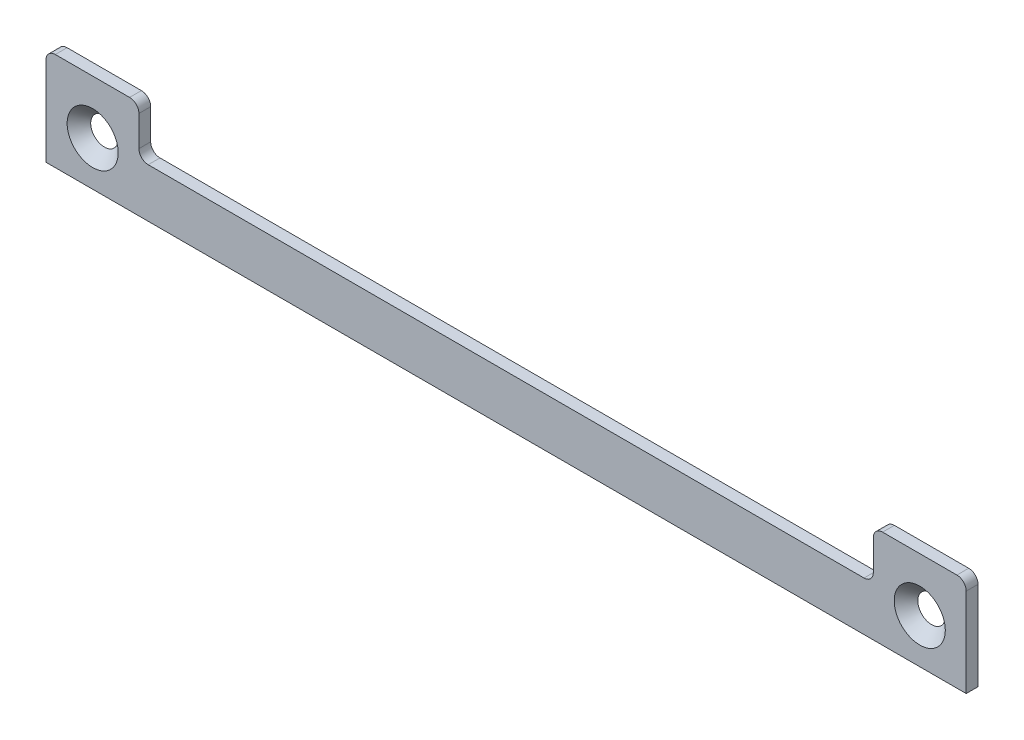
from build123d import *

# Parameters (mm, degrees)
BOSS_EXTRUDE1_DEPTH                          = 1.27
FILLET1_R                                    = 1
CSK_FOR_M2_5_COUNTERSUNK_RAISED_HEAD_2_COUNT = 2
CSK_FOR_M2_5_COUNTERSUNK_RAISED_HEAD_2_PITCH = 89.03694267


with BuildPart() as part:
    # Sketch1 → Boss-Extrude1 (new body)
    with BuildSketch(Plane.XY):
        Polygon((-38.499957014, 0), (60.560042986, 0), (60.560042986, 10.550876612), (50.560042986, 10.550876612), (50.560042986, 5.275438306), (-28.499957014, 5.275438306), (-28.499957014, 10.550876612), (-38.499957014, 10.550876612), align=None)
    extrude(amount=BOSS_EXTRUDE1_DEPTH)

    # Fillet1
    fillet1_edges = [part.edges().sort_by_distance(p)[0] for p in [
        (-38.499957014, 10.550876612, 0.635),
        (-28.499957014, 10.550876612, 0.635),
        (-28.499957014, 5.275438306, 0.635),
        (50.560042986, 5.275438306, 0.635),
        (50.560042986, 10.550876612, 0.635),
        (60.560042986, 10.550876612, 0.635),
    ]]
    fillet(fillet1_edges, radius=FILLET1_R)

    # Sketch6 → CSK for M2.5 Countersunk Raised Head Screw1 (revolve, cut)
    with BuildSketch(Plane(origin=(-33.476617277, 4.775438306, 1.27), x_dir=(0, -1, 0), z_dir=(1, 0, 0))):
        Polygon((0, 0), (0, 1.27), (1.45, 1.27), (1.45, 1.3), (2.75, 0), align=None)
    csk_for_m2_5_countersunk_raised_head_scr = revolve(axis=Axis((-33.476617277, 4.775438306, 7.62), (0, 0, -1)), mode=Mode.SUBTRACT)

    # CSK for M2.5 Countersunk Raised Head 2: CSK for M2.5 Countersunk Raised Head Screw1 ×2
    with Locations(*[(i * CSK_FOR_M2_5_COUNTERSUNK_RAISED_HEAD_2_PITCH, 0, 0) for i in range(1, CSK_FOR_M2_5_COUNTERSUNK_RAISED_HEAD_2_COUNT)]):
        add(csk_for_m2_5_countersunk_raised_head_scr, mode=Mode.SUBTRACT)


solid = part.part
